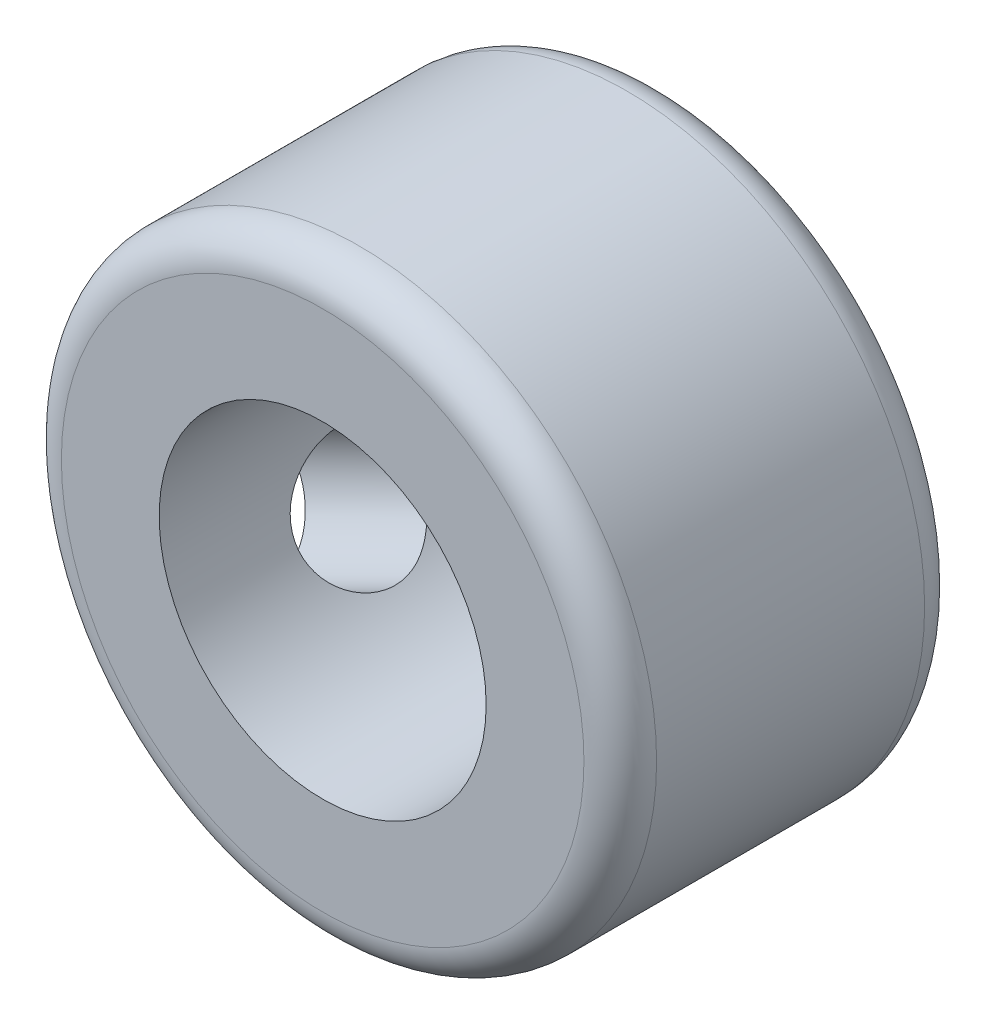
from build123d import *

# Parameters (mm, degrees)
ESQUISSE1_R           = 6.24205
ESQUISSE1_R_2         = 3.429
BOSS_EXTRU_1_DEPTH    = 7.14502
CONG_1_R              = 0.762
D_GAGEMENT_M21_REACH  = 17.35
D_GAGEMENT_M21_BORE_R = 1.3


with BuildPart() as part:
    # Esquisse1 → Boss.-Extru.1 (new body)
    with BuildSketch(Plane.XY):
        with Locations(Location((0, 0, 0), (0, 0, 180))):
            Circle(ESQUISSE1_R)
        with Locations(Location((0, 0, 0), (0, 0, 180))):
            Circle(ESQUISSE1_R_2, mode=Mode.SUBTRACT)
    extrude(amount=BOSS_EXTRU_1_DEPTH)

    # Congé1
    cong_1_edges = [part.edges().sort_by_distance(p)[0] for p in [
        (6.24205, 0, 0),
        (6.24205, 0, 7.14502),
    ]]
    fillet(cong_1_edges, radius=CONG_1_R)

    # Dégagement M21 bore (on position points) → Dégagement M21 (cut, up to next)
    with BuildSketch(Plane(origin=(-5.594728997, -2.768067132, 3.359647544), x_dir=(0.44345481566, -0.896296729029, 0), z_dir=(-0.896296729029, -0.44345481566, 0)), mode=Mode.PRIVATE) as d_gagement_m21_sk1:
        Circle(D_GAGEMENT_M21_BORE_R)
    d_gagement_m21_tool1 = extrude(d_gagement_m21_sk1.sketch, amount=-D_GAGEMENT_M21_REACH, mode=Mode.PRIVATE) & part.part
    add(d_gagement_m21_tool1.solids().sort_by_distance((-5.594729, -2.768067, 3.359648))[0], mode=Mode.SUBTRACT)


solid = part.part
